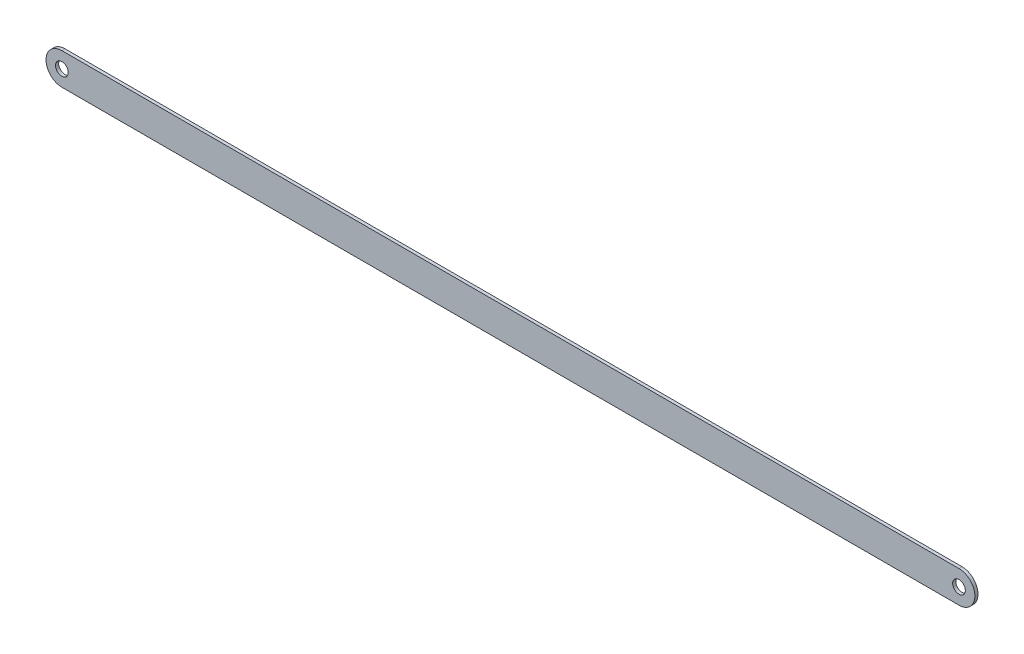
from build123d import *

# Parameters (mm, degrees)
BOSS_EXTRUDE1_DEPTH = 0.5
SKETCH2_R           = 2.032
SKETCH2_R_2         = 2.026725148
CUT_EXTRUDE1_DEPTH  = 2.54


with BuildPart() as part:
    # Sketch1 → Boss-Extrude1 (new, symmetric)
    with BuildSketch(Plane.XY):
        with BuildLine():
            Line((0, 0), (287.02, 0))
            ThreePointArc((287.02, 0), (292.1, 5.08), (287.02, 10.16))
            Line((287.02, 10.16), (0, 10.16))
            ThreePointArc((0, 10.16), (-5.08, 5.08), (0, 0))
        make_face()
    extrude(amount=BOSS_EXTRUDE1_DEPTH, both=True)

    # Sketch2 → Cut-Extrude1 (cut)
    with BuildSketch(Plane.XY.offset(0.5)):
        with Locations((0, 5.08)):
            Circle(SKETCH2_R)
        with Locations((287.02, 5.08)):
            Circle(SKETCH2_R_2)
    extrude(amount=-CUT_EXTRUDE1_DEPTH, mode=Mode.SUBTRACT)


solid = part.part
